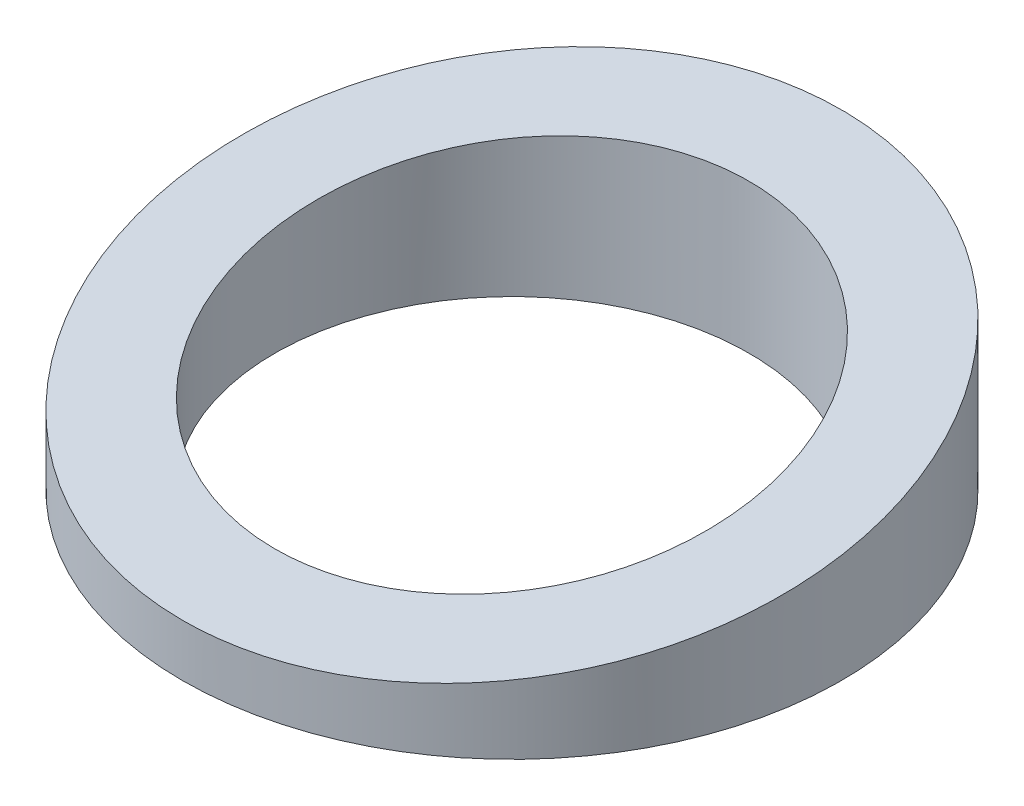
from build123d import *

# Parameters (mm, degrees)
SKETCH1_R               = 3.175
BOSS_EXTRUDE1_DEPTH     = 1.5875
CUT_EXTRUDE2_DEPTH      = 5.7625
CUT_EXTRUDE2_DEPTH_BACK = 5.7625
CUT_EXTRUDE3_DEPTH      = 5.7625
CUT_EXTRUDE3_DEPTH_BACK = 5.7625
SKETCH3_R               = 2.286


with BuildPart() as part:
    # Sketch1 → Boss-Extrude1 (new body)
    with BuildSketch(Plane(origin=(0, 0, 0), x_dir=(1, 0, 0), z_dir=(0, 1, 0))):
        with Locations(Location((0, 0, 0), (0, 0, 270))):
            Circle(SKETCH1_R)
    extrude(amount=BOSS_EXTRUDE1_DEPTH)

    # Sketch2 → Cut-Extrude2 (cut, two sides: drawn at the far end of the back side and taken through both)
    with BuildSketch(Plane(origin=(0, 0, 0), x_dir=(0, 0, -1), z_dir=(1, 0, 0)).offset(-CUT_EXTRUDE2_DEPTH_BACK)):
        Polygon((3.175, 1.5875), (-3.175, 0.503215254), (-3.175, 1.5875), align=None)
    extrude(amount=CUT_EXTRUDE2_DEPTH + CUT_EXTRUDE2_DEPTH_BACK, mode=Mode.SUBTRACT)

    # Sketch3 → Cut-Extrude3 (cut, two sides: drawn at the far end of the back side and taken through both)
    with BuildSketch(Plane.XZ.offset(-CUT_EXTRUDE3_DEPTH_BACK)):
        with Locations(Location((0, 0, 0), (0, 0, 90))):
            Circle(SKETCH3_R)
    extrude(amount=CUT_EXTRUDE3_DEPTH + CUT_EXTRUDE3_DEPTH_BACK, mode=Mode.SUBTRACT)


solid = part.part
